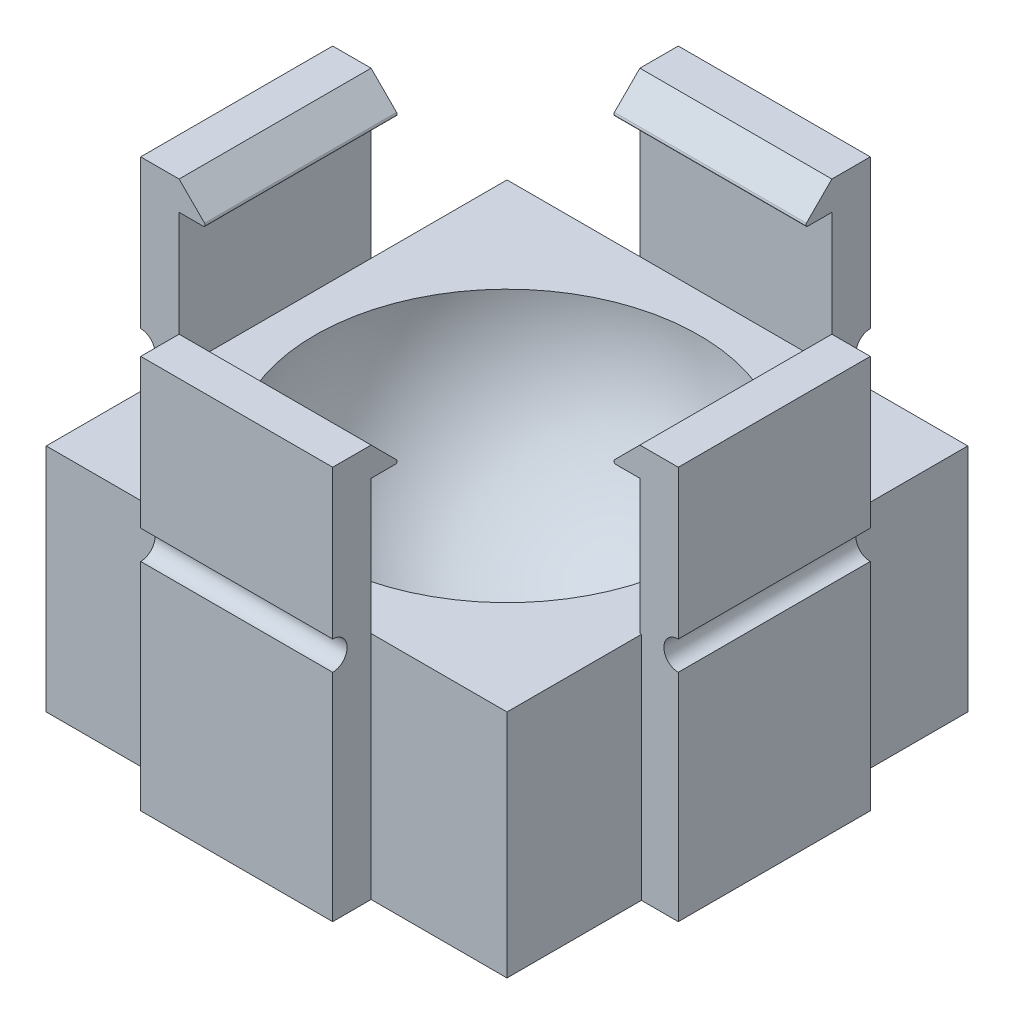
from build123d import *

# Parameters (mm, degrees)
SKETCH1_W               = 250
SKETCH1_H               = 250
BOSS_EXTRUDE1_DEPTH     = 5
SKETCH2_W               = 24
SKETCH2_H               = 24
BOSS_EXTRUDE2_DEPTH     = 12
BOSS_EXTRUDE3_DEPTH     = 19
BOSS_EXTRUDE5_DEPTH     = 10
BOSS_EXTRUDE6_DEPTH     = 10
BOSS_EXTRUDE7_DEPTH     = 10
BOSS_EXTRUDE8_DEPTH     = 10
SKETCH12_R              = 0.75
CUT_EXTRUDE1_DEPTH      = 347.058798176
SKETCH13_R              = 0.75
CUT_EXTRUDE2_DEPTH      = 283.931528819
SKETCH14_R              = 0.75
CUT_EXTRUDE3_DEPTH      = 283.931528819
SKETCH15_R              = 0.75
CUT_EXTRUDE4_DEPTH      = 283.931528819
FILLET1_R               = 0.1
CUT_EXTRUDE5_DEPTH      = 2.3
CUT_EXTRUDE6_DEPTH      = 355.313759259
BOSS_EXTRUDE9_START     = -150
BOSS_EXTRUDE9_DEPTH     = 80
BOSS_EXTRUDE10_START    = 20
BOSS_EXTRUDE10_DEPTH    = 40
BOSS_EXTRUDE11_DEPTH    = 6
SKETCH22_W              = 22.6
SKETCH22_H              = 27
BOSS_EXTRUDE12_DEPTH    = 2
CUT_EXTRUDE7_START      = -4
SKETCH23_W              = 3
SKETCH23_H              = 8
CUT_EXTRUDE7_DEPTH      = 4
CUT_EXTRUDE8_DEPTH      = 6
BOSS_EXTRUDE13_START    = 5
BOSS_EXTRUDE13_DEPTH    = 3
BOSS_EXTRUDE14_START    = 5
BOSS_EXTRUDE14_DEPTH    = 3
CUT_EXTRUDE9_DEPTH      = 355.147215152
CUT_EXTRUDE9_DEPTH_BACK = 355.147215152
SKETCH29_W              = 55.476863103
SKETCH29_H              = 5
CUT_EXTRUDE10_DEPTH     = 257.874477746


with BuildPart() as part:
    # Sketch1 → Boss-Extrude1 (new body)
    with BuildSketch(Plane(origin=(0, 0, 0), x_dir=(1, 0, 0), z_dir=(0, 1, 0))):
        with Locations((125, 125)):
            Rectangle(SKETCH1_W, SKETCH1_H)
    extrude(amount=BOSS_EXTRUDE1_DEPTH)

    # Sketch2 → Boss-Extrude2 (add)
    with BuildSketch(Plane(origin=(0, 5, 0), x_dir=(1, 0, 0), z_dir=(0, 1, 0))):
        with Locations((125, 125)):
            Rectangle(SKETCH2_W, SKETCH2_H)
        with Locations((233, 125)):
            Rectangle(SKETCH2_W, SKETCH2_H)
        with Locations((125, 17.078916875)):
            Rectangle(SKETCH2_W, SKETCH2_H)
    extrude(amount=BOSS_EXTRUDE2_DEPTH)

    # Sketch4 → Cut-Revolve1 (revolve, cut)
    with BuildSketch(Plane(origin=(0, 17, 0), x_dir=(1, 0, 0), z_dir=(0, 1, 0))):
        with BuildLine():
            Line((125, 115), (125, 135))
            ThreePointArc((125, 135), (115, 125), (125, 115))
        make_face()
    revolve(axis=Axis((125, 17, -135), (0, 0, 1)), mode=Mode.SUBTRACT)

    # Sketch4<3> → Cut-Revolve2 (revolve, cut)
    with BuildSketch(Plane(origin=(0, 17, 0), x_dir=(1, 0, 0), z_dir=(0, 1, 0))):
        with BuildLine():
            Line((233, 135), (233, 115))
            ThreePointArc((233, 115), (243, 125), (233, 135))
        make_face()
    revolve(axis=Axis((233, 17, -135), (0, 0, 1)), mode=Mode.SUBTRACT)

    # Sketch4<4> → Cut-Revolve3 (revolve, cut)
    with BuildSketch(Plane(origin=(0, 17, 0), x_dir=(1, 0, 0), z_dir=(0, 1, 0))):
        with BuildLine():
            Line((125, 7), (125, 27))
            ThreePointArc((125, 27), (115, 17), (125, 7))
        make_face()
    revolve(axis=Axis((125, 17, -7), (0, 0, -1)), mode=Mode.SUBTRACT)

    # Sketch5 → Boss-Extrude3 (add)
    with BuildSketch(Plane(origin=(0, 5, 0), x_dir=(1, 0, 0), z_dir=(0, 1, 0))):
        Polygon((125, 137), (130, 137), (130, 139), (120, 139), (120, 137), align=None)
        Polygon((120, 113), (125, 113), (130, 113), (130, 111), (120, 111), align=None)
        Polygon((125, 29.078916875), (130, 29.078916875), (130, 31.078916875), (120, 31.078916875), (120, 29.078916875), align=None)
        Polygon((120, 5.078916875), (125, 5.078916875), (130, 5.078916875), (130, 3.078916875), (120, 3.078916875), align=None)
        Polygon((113, 130), (113, 125), (113, 120), (111, 120), (111, 130), align=None)
        Polygon((137, 125), (137, 120), (139, 120), (139, 130), (137, 130), align=None)
        Polygon((220.921083125, 130), (220.921083125, 125), (220.921083125, 120), (218.921083125, 120), (218.921083125, 130), align=None)
        Polygon((244.921083125, 125), (244.921083125, 120), (246.921083125, 120), (246.921083125, 130), (244.921083125, 130), align=None)
        Polygon((137, 12.078916875), (137, 17.078916875), (137, 22.078916875), (139, 22.078916875), (139, 12.078916875), align=None)
        Polygon((113, 17.078916875), (113, 22.078916875), (111, 22.078916875), (111, 12.078916875), (113, 12.078916875), align=None)
        Polygon((237.921083125, 137), (232.921083125, 137), (227.921083125, 137), (227.921083125, 139), (237.921083125, 139), align=None)
        Polygon((232.921083125, 113), (227.921083125, 113), (227.921083125, 111), (237.921083125, 111), (237.921083125, 113), align=None)
    extrude(amount=BOSS_EXTRUDE3_DEPTH)

    # Sketch8 → Boss-Extrude5 (add)
    with BuildSketch(Plane.ZY.offset(-120)):
        Polygon((-3.078916875, 24), (-6.578916875, 24), (-5.078916875, 25.5), (-3.078916875, 25.5), align=None)
        Polygon((-29.078916875, 25.5), (-27.578916875, 24), (-31.078916875, 24), (-31.078916875, 25.5), align=None)
        Polygon((-111, 24), (-114.5, 24), (-113, 25.5), (-111, 25.5), align=None)
        Polygon((-137, 25.5), (-135.5, 24), (-139, 24), (-139, 25.5), align=None)
    extrude(amount=-BOSS_EXTRUDE5_DEPTH)

    # Sketch9 → Boss-Extrude6 (add)
    with BuildSketch(Plane(origin=(0, 0, -130), x_dir=(-1, 0, 0), z_dir=(0, 0, -1))):
        Polygon((-111, 24), (-114.5, 24), (-113, 25.5), (-111, 25.5), align=None)
        Polygon((-137, 25.5), (-135.5, 24), (-139, 24), (-139, 25.5), align=None)
        Polygon((-218.921083125, 24), (-222.421083125, 24), (-220.921083125, 25.5), (-218.921083125, 25.5), align=None)
        Polygon((-244.921083125, 25.5), (-243.421083125, 24), (-246.921083125, 24), (-246.921083125, 25.5), align=None)
    extrude(amount=-BOSS_EXTRUDE6_DEPTH)

    # Sketch10 → Boss-Extrude7 (add)
    with BuildSketch(Plane(origin=(237.921083125, 0, 0), x_dir=(0, 0, -1), z_dir=(1, 0, 0))):
        Polygon((139, 24), (135.5, 24), (137, 25.5), (139, 25.5), align=None)
        Polygon((111, 25.5), (111, 24), (114.5, 24), (113, 25.5), align=None)
    extrude(amount=-BOSS_EXTRUDE7_DEPTH)

    # Sketch11 → Boss-Extrude8 (add)
    with BuildSketch(Plane.XY.offset(-12.078916875)):
        Polygon((139, 24), (135.5, 24), (137, 25.5), (139, 25.5), align=None)
        Polygon((111, 25.5), (111, 24), (114.5, 24), (113, 25.5), align=None)
    extrude(amount=-BOSS_EXTRUDE8_DEPTH)

    # Sketch12 → Cut-Extrude1 (cut, through all)
    with BuildSketch(Plane.XY.offset(-12.078916875)):
        with Locations((139, 17)):
            Circle(SKETCH12_R)
        with Locations((111, 17)):
            Circle(SKETCH12_R)
    extrude(amount=-CUT_EXTRUDE1_DEPTH, mode=Mode.SUBTRACT)

    # Sketch13 → Cut-Extrude2 (cut, through all)
    with BuildSketch(Plane.ZY.offset(-120)):
        with Locations((-111, 17)):
            Circle(SKETCH13_R)
        with Locations((-139, 17)):
            Circle(SKETCH13_R)
    extrude(amount=-CUT_EXTRUDE2_DEPTH, mode=Mode.SUBTRACT)

    # Sketch14 → Cut-Extrude3 (cut, through all)
    with BuildSketch(Plane(origin=(0, 0, -130), x_dir=(-1, 0, 0), z_dir=(0, 0, -1))):
        with Locations((-218.921083125, 17)):
            Circle(SKETCH14_R)
        with Locations((-246.921083125, 17)):
            Circle(SKETCH14_R)
    extrude(amount=-CUT_EXTRUDE3_DEPTH, mode=Mode.SUBTRACT)

    # Sketch15 → Cut-Extrude4 (cut, through all)
    with BuildSketch(Plane(origin=(130, 0, 0), x_dir=(0, 0, -1), z_dir=(1, 0, 0))):
        with Locations((31.078916875, 17)):
            Circle(SKETCH15_R)
        with Locations((3.078916875, 17)):
            Circle(SKETCH15_R)
    extrude(amount=-CUT_EXTRUDE4_DEPTH, mode=Mode.SUBTRACT)

    # Fillet1
    fillet1_edges = [part.edges().sort_by_distance(p)[0] for p in [
        (232.921083125, 24, -135.5),
        (243.421083125, 24, -125),
        (232.921083125, 24, -114.5),
        (222.421083125, 24, -125),
        (114.5, 24, -125),
        (125, 24, -135.5),
        (125, 24, -114.5),
        (135.5, 24, -125),
        (135.5, 24, -17.078916875),
        (125, 24, -6.578916875),
        (114.5, 24, -17.078916875),
        (125, 24, -27.578916875),
    ]]
    fillet(fillet1_edges, radius=FILLET1_R)

    # Sketch17 → Cut-Extrude5 (cut)
    with BuildSketch(Plane.XZ):
        with BuildLine():
            Line((125.35, -232.7), (124.65, -232.7))
            ThreePointArc((124.65, -232.7), (122.35, -235), (124.65, -237.3))
            Line((124.65, -237.3), (125, -237.3))
            Line((125, -237.3), (125.35, -237.3))
            ThreePointArc((125.35, -237.3), (127.65, -235), (125.35, -232.7))
        make_face()
        with BuildLine():
            ThreePointArc((12.7, -125.35), (15, -127.65), (17.3, -125.35))
            Line((17.3, -125.35), (17.3, -124.65))
            ThreePointArc((17.3, -124.65), (15, -122.35), (12.7, -124.65))
            Line((12.7, -124.65), (12.7, -125.35))
        make_face()
    extrude(amount=-CUT_EXTRUDE5_DEPTH, mode=Mode.SUBTRACT)

    # Sketch18 → Cut-Extrude6 (cut, through all)
    with BuildSketch(Plane.XZ.offset(-2.3)):
        with BuildLine():
            Line((12.843614135, -123.85), (17.156385865, -123.85))
            ThreePointArc((17.156385865, -123.85), (15, -122.35), (12.843614135, -123.85))
        make_face()
        with BuildLine():
            ThreePointArc((12.843614135, -126.15), (15, -127.65), (17.156385865, -126.15))
            Line((17.156385865, -126.15), (12.843614135, -126.15))
        make_face()
        with BuildLine():
            Line((123.85, -237.156385865), (123.85, -232.843614135))
            ThreePointArc((123.85, -232.843614135), (122.35, -235), (123.85, -237.156385865))
        make_face()
        with BuildLine():
            ThreePointArc((126.15, -237.156385865), (127.65, -235), (126.15, -232.843614135))
            Line((126.15, -232.843614135), (126.15, -237.156385865))
        make_face()
    extrude(amount=-CUT_EXTRUDE6_DEPTH, mode=Mode.SUBTRACT)

    # Sketch19 → Boss-Extrude9 (add)
    with BuildSketch(Plane.XY.offset(BOSS_EXTRUDE9_START)):
        with BuildLine():
            Line((120, 5), (121, 5))
            ThreePointArc((121, 5), (125, 9), (129, 5))
            Line((129, 5), (130, 5))
            ThreePointArc((130, 5), (125, 10), (120, 5))
        make_face()
    extrude(amount=-BOSS_EXTRUDE9_DEPTH)

    # Sketch20 → Boss-Extrude10 (add)
    with BuildSketch(Plane(origin=(0, 0, 0), x_dir=(0, 0, -1), z_dir=(1, 0, 0)).offset(BOSS_EXTRUDE10_START)):
        with BuildLine():
            Line((120, 5), (121, 5))
            ThreePointArc((121, 5), (125, 9), (129, 5))
            Line((129, 5), (130, 5))
            ThreePointArc((130, 5), (125, 10), (120, 5))
        make_face()
    extrude(amount=BOSS_EXTRUDE10_DEPTH)

    # Sketch21 → Boss-Extrude11 (add)
    with BuildSketch(Plane(origin=(0, 5, 0), x_dir=(1, 0, 0), z_dir=(0, 1, 0))):
        Polygon((85.204623334, 138.5), (65.604623334, 138.5), (65.604623334, 111.5), (85.204623334, 111.5), (88.204623334, 111.5), (88.204623334, 122.5), (85.204623334, 122.5), (85.204623334, 114.5), (68.604623334, 114.5), (68.604623334, 135.5), (85.204623334, 135.5), align=None)
    extrude(amount=BOSS_EXTRUDE11_DEPTH)

    # Sketch22 → Boss-Extrude12 (add)
    with BuildSketch(Plane(origin=(0, 11, 0), x_dir=(1, 0, 0), z_dir=(0, 1, 0))):
        with Locations((76.904623334, 125)):
            Rectangle(SKETCH22_W, SKETCH22_H)
    extrude(amount=BOSS_EXTRUDE12_DEPTH)

    # Sketch23 → Cut-Extrude7 (cut)
    with BuildSketch(Plane(origin=(0, 13, 0), x_dir=(1, 0, 0), z_dir=(0, 1, 0)).offset(CUT_EXTRUDE7_START)):
        with Locations((86.704623334, 118.5)):
            Rectangle(SKETCH23_W, SKETCH23_H)
    extrude(amount=-CUT_EXTRUDE7_DEPTH, mode=Mode.SUBTRACT)

    # Sketch24 → Cut-Extrude8 (cut)
    with BuildSketch(Plane.ZY.offset(-65.604623334)):
        with BuildLine():
            Line((-127, 5), (-123, 5))
            ThreePointArc((-123, 5), (-125, 7), (-127, 5))
        make_face()
    extrude(amount=-CUT_EXTRUDE8_DEPTH, mode=Mode.SUBTRACT)

    # Sketch26 → Boss-Extrude13 (add)
    with BuildSketch(Plane(origin=(0, 5, 0), x_dir=(1, 0, 0), z_dir=(0, 1, 0)).offset(BOSS_EXTRUDE13_START)):
        with BuildLine():
            Line((111, 130), (111, 128))
            ThreePointArc((111, 128), (108, 125), (111, 122))
            Line((111, 122), (111, 120))
            ThreePointArc((111, 120), (106, 125), (111, 130))
        make_face()
    extrude(amount=BOSS_EXTRUDE13_DEPTH)

    # Sketch27 → Boss-Extrude14 (add)
    with BuildSketch(Plane(origin=(0, 5, 0), x_dir=(1, 0, 0), z_dir=(0, 1, 0)).offset(BOSS_EXTRUDE14_START)):
        with BuildLine():
            Line((120, 139), (122, 139))
            ThreePointArc((122, 139), (125, 142), (128, 139))
            Line((128, 139), (130, 139))
            ThreePointArc((130, 139), (125, 144), (120, 139))
        make_face()
    extrude(amount=BOSS_EXTRUDE14_DEPTH)

    # Sketch28 → Cut-Extrude9 (cut, two sides: drawn at the far end of the back side and taken through both)
    with BuildSketch(Plane(origin=(0, 5, 0), x_dir=(1, 0, 0), z_dir=(0, 1, 0)).offset(-CUT_EXTRUDE9_DEPTH_BACK)):
        Polygon((250, 0), (250, 96.237969813), (194.523136897, 96.237969813), (194.523136897, 149.475619246), (250, 149.475619246), (250, 250), (0, 250), (0, 0), align=None)
    extrude(amount=CUT_EXTRUDE9_DEPTH + CUT_EXTRUDE9_DEPTH_BACK, mode=Mode.SUBTRACT)

    # Sketch29 → Cut-Extrude10 (cut, through all)
    with BuildSketch(Plane(origin=(0, 0, -149.475619246), x_dir=(-1, 0, 0), z_dir=(0, 0, -1))):
        with Locations((-222.261568449, 2.5)):
            Rectangle(SKETCH29_W, SKETCH29_H)
    extrude(amount=-CUT_EXTRUDE10_DEPTH, mode=Mode.SUBTRACT)


with BuildPart() as cut_extrude10_piece_1:
    # of the separate pieces the step leaves, piece 1, a body of its own (cut_extrude10_pieces)
    add(part.part.solids().sort_by_distance((237.921083125, 24, -114.258578644))[0])


with BuildPart() as cut_extrude10_piece_2:
    # of the separate pieces the step leaves, piece 2, a body of its own (cut_extrude10_pieces)
    add(part.part.solids().sort_by_distance((220.921083125, 5, -130))[0])


solid = Compound([cut_extrude10_piece_1.part, cut_extrude10_piece_2.part])
